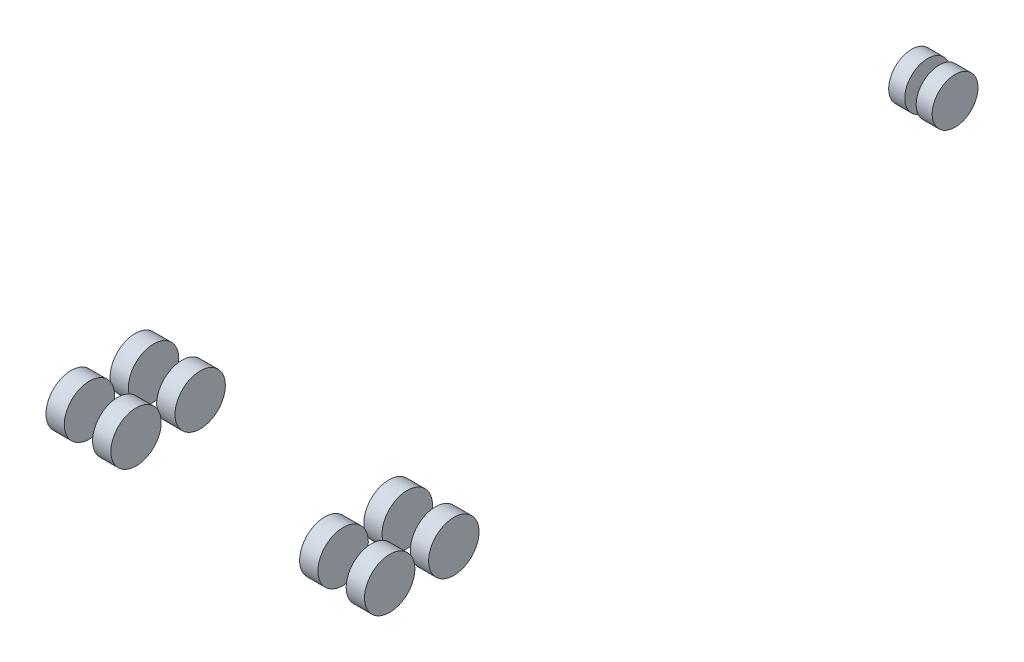
from build123d import *

# Parameters (mm, degrees)
MAIN_TIRE_1_DEPTH        = 203.2
MAIN_TIRE_1_DEPTH_BACK   = 203.2
SKETCH9_R                = 558.8
MAIN_TIRE_1_2_DEPTH      = 203.2
MAIN_TIRE_1_2_DEPTH_BACK = 203.2
MAIN_TIRE_2_DEPTH        = 203.2
MAIN_TIRE_2_DEPTH_BACK   = 203.2
SKETCH10_R               = 558.8
MAIN_TIRE_2_2_DEPTH      = 203.2
MAIN_TIRE_2_2_DEPTH_BACK = 203.2
MAIN_TIRE_3_DEPTH        = 203.2
MAIN_TIRE_3_DEPTH_BACK   = 203.2
SKETCH12_R               = 558.8
MAIN_TIRE_3_2_DEPTH      = 203.2
MAIN_TIRE_3_2_DEPTH_BACK = 203.2
MAIN_TIRE_4_DEPTH        = 203.2
MAIN_TIRE_4_DEPTH_BACK   = 203.2
SKETCH13_R               = 558.8
MAIN_TIRE_4_2_DEPTH      = 203.2
MAIN_TIRE_4_2_DEPTH_BACK = 203.2
NOSE_TIRE_1_DEPTH        = 177.8
NOSE_TIRE_1_DEPTH_BACK   = 177.8
SKETCH14_R               = 508
NOSE_TIRE_2_DEPTH        = 177.8
NOSE_TIRE_2_DEPTH_BACK   = 177.8
SKETCH15_R               = 508


with BuildPart() as part:
    # Sketch9 → Main tire 1 (new, two sides: drawn at the far end of the back side and taken through both)
    with BuildSketch(Plane(origin=(-2296.616197494, 0, 0), x_dir=(0, 0, -1), z_dir=(1, 0, 0)).offset(-MAIN_TIRE_1_DEPTH_BACK)):
        with Locations((-3400.7552, 558.8)):
            Circle(SKETCH9_R)
    extrude(amount=MAIN_TIRE_1_DEPTH + MAIN_TIRE_1_DEPTH_BACK)


with BuildPart() as body_2:
    # Sketch9 → Main tire 1 2 (new, two sides: drawn at the far end of the back side and taken through both)
    with BuildSketch(Plane(origin=(-2296.616197494, 0, 0), x_dir=(0, 0, -1), z_dir=(1, 0, 0)).offset(-MAIN_TIRE_1_2_DEPTH_BACK)):
        with Locations((-1978.3552, 558.8)):
            Circle(SKETCH9_R)
    extrude(amount=MAIN_TIRE_1_2_DEPTH + MAIN_TIRE_1_2_DEPTH_BACK)


with BuildPart() as body_3:
    # Sketch10 → Main tire 2 (new, two sides: drawn at the far end of the back side and taken through both)
    with BuildSketch(Plane(origin=(-3330.050289329, 0, 0), x_dir=(0, 0, -1), z_dir=(1, 0, 0)).offset(-MAIN_TIRE_2_DEPTH_BACK)):
        with Locations((-3400.7552, 558.8)):
            Circle(SKETCH10_R)
    extrude(amount=MAIN_TIRE_2_DEPTH + MAIN_TIRE_2_DEPTH_BACK)


with BuildPart() as body_4:
    # Sketch10 → Main tire 2 2 (new, two sides: drawn at the far end of the back side and taken through both)
    with BuildSketch(Plane(origin=(-3330.050289329, 0, 0), x_dir=(0, 0, -1), z_dir=(1, 0, 0)).offset(-MAIN_TIRE_2_2_DEPTH_BACK)):
        with Locations((-1978.3552, 558.8)):
            Circle(SKETCH10_R)
    extrude(amount=MAIN_TIRE_2_2_DEPTH + MAIN_TIRE_2_2_DEPTH_BACK)


with BuildPart() as body_5:
    # Sketch12 → Main tire 3 (new, two sides: drawn at the far end of the back side and taken through both)
    with BuildSketch(Plane(origin=(2296.616197494, 0, 0), x_dir=(0, 0, -1), z_dir=(1, 0, 0)).offset(-MAIN_TIRE_3_DEPTH_BACK)):
        with Locations((-1978.3552, 558.8)):
            Circle(SKETCH12_R)
    extrude(amount=MAIN_TIRE_3_DEPTH + MAIN_TIRE_3_DEPTH_BACK)


with BuildPart() as body_6:
    # Sketch12 → Main tire 3 2 (new, two sides: drawn at the far end of the back side and taken through both)
    with BuildSketch(Plane(origin=(2296.616197494, 0, 0), x_dir=(0, 0, -1), z_dir=(1, 0, 0)).offset(-MAIN_TIRE_3_2_DEPTH_BACK)):
        with Locations((-3400.7552, 558.8)):
            Circle(SKETCH12_R)
    extrude(amount=MAIN_TIRE_3_2_DEPTH + MAIN_TIRE_3_2_DEPTH_BACK)


with BuildPart() as body_7:
    # Sketch13 → Main tire 4 (new, two sides: drawn at the far end of the back side and taken through both)
    with BuildSketch(Plane(origin=(3330.050289329, 0, 0), x_dir=(0, 0, -1), z_dir=(1, 0, 0)).offset(-MAIN_TIRE_4_DEPTH_BACK)):
        with Locations((-3400.7552, 558.8)):
            Circle(SKETCH13_R)
    extrude(amount=MAIN_TIRE_4_DEPTH + MAIN_TIRE_4_DEPTH_BACK)


with BuildPart() as body_8:
    # Sketch13 → Main tire 4 2 (new, two sides: drawn at the far end of the back side and taken through both)
    with BuildSketch(Plane(origin=(3330.050289329, 0, 0), x_dir=(0, 0, -1), z_dir=(1, 0, 0)).offset(-MAIN_TIRE_4_2_DEPTH_BACK)):
        with Locations((-1978.3552, 558.8)):
            Circle(SKETCH13_R)
    extrude(amount=MAIN_TIRE_4_2_DEPTH + MAIN_TIRE_4_2_DEPTH_BACK)


with BuildPart() as body_9:
    # Sketch14 → Nose tire 1 (new, two sides: drawn at the far end of the back side and taken through both)
    with BuildSketch(Plane(origin=(-304.8, 0, 0), x_dir=(0, 0, -1), z_dir=(1, 0, 0)).offset(-NOSE_TIRE_1_DEPTH_BACK)):
        with Locations((12192, 508)):
            Circle(SKETCH14_R)
    extrude(amount=NOSE_TIRE_1_DEPTH + NOSE_TIRE_1_DEPTH_BACK)


with BuildPart() as body_10:
    # Sketch15 → Nose tire 2 (new, two sides: drawn at the far end of the back side and taken through both)
    with BuildSketch(Plane(origin=(304.8, 0, 0), x_dir=(0, 0, -1), z_dir=(1, 0, 0)).offset(-NOSE_TIRE_2_DEPTH_BACK)):
        with Locations((12192, 508)):
            Circle(SKETCH15_R)
    extrude(amount=NOSE_TIRE_2_DEPTH + NOSE_TIRE_2_DEPTH_BACK)


solid = Compound([part.part, body_2.part, body_3.part, body_4.part, body_5.part, body_6.part, body_7.part, body_8.part, body_9.part, body_10.part])
